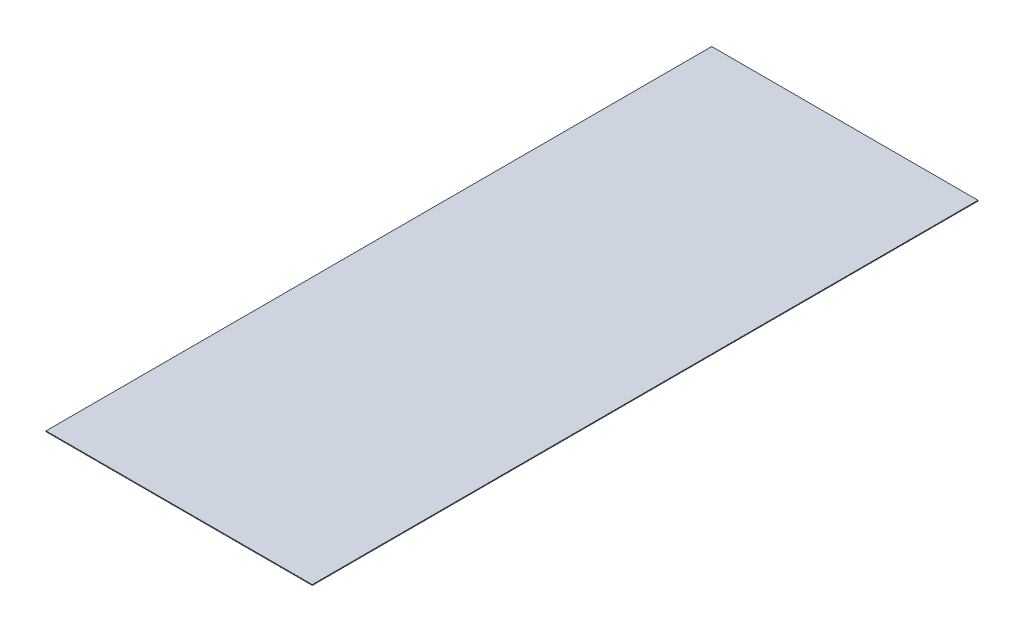
from build123d import *

# Parameters (mm, degrees)
CROQUIS1_W              = 1219.2
CROQUIS1_H              = 3048
SALIENTE_EXTRUIR1_DEPTH = 3.4


with BuildPart() as part:
    # Croquis1 → Saliente-Extruir1 (new body)
    with BuildSketch(Plane(origin=(0, 0, 0), x_dir=(1, 0, 0), z_dir=(0, 1, 0))):
        Rectangle(CROQUIS1_W, CROQUIS1_H)
    extrude(amount=SALIENTE_EXTRUIR1_DEPTH)


solid = part.part
